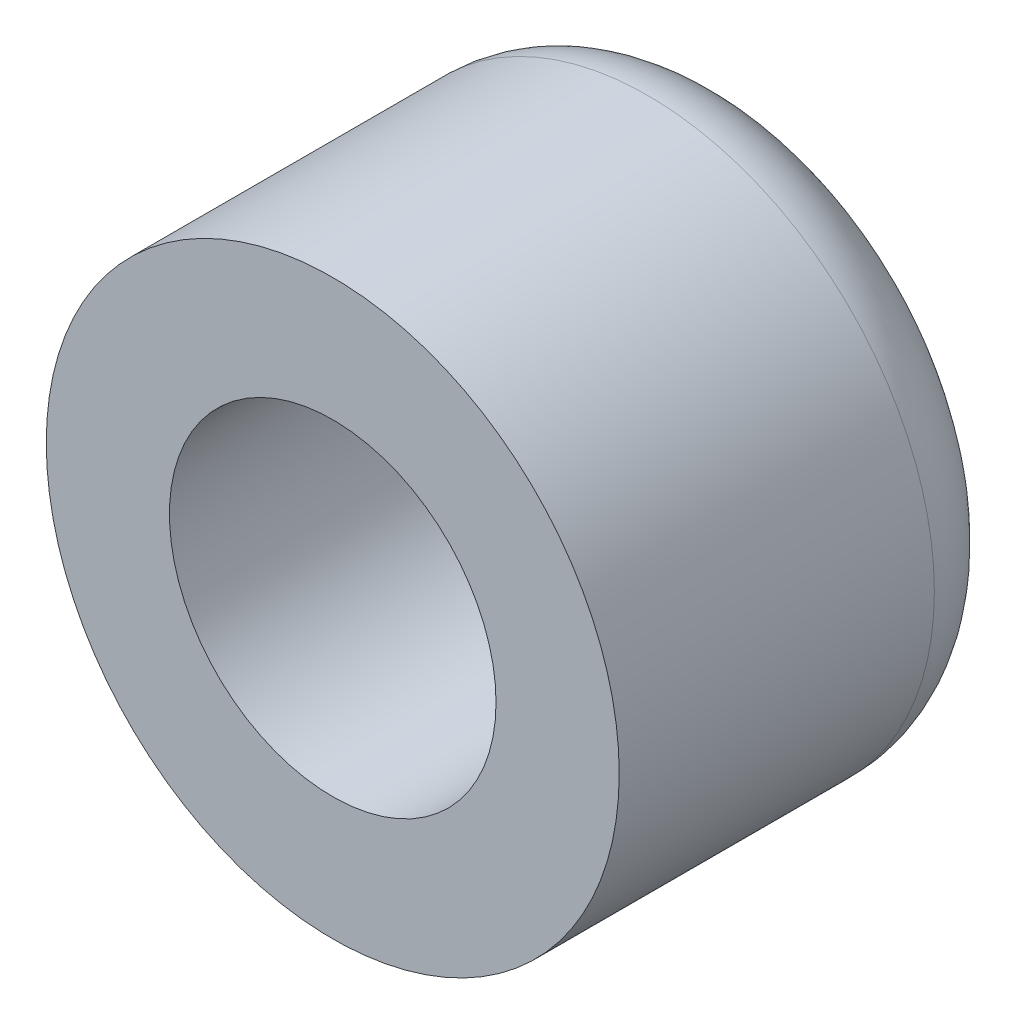
from build123d import *

# Parameters (mm, degrees)
SKETCH1_R           = 5
BOSS_EXTRUDE1_DEPTH = 7
SKETCH2_R           = 2.85
CUT_EXTRUDE1_DEPTH  = 5.5
FILLET1_R           = 1.5


with BuildPart() as part:
    # Sketch1 → Boss-Extrude1 (new body)
    with BuildSketch(Plane(origin=(0, 0, 0), x_dir=(0, 1, 0), z_dir=(0, 0, 1))):
        with Locations(Location((0, 0, 0), (0, 0, 270))):
            Circle(SKETCH1_R)
    extrude(amount=BOSS_EXTRUDE1_DEPTH)

    # Sketch2 → Cut-Extrude1 (cut)
    with BuildSketch(Plane.XY.offset(7)):
        Circle(SKETCH2_R)
    extrude(amount=-CUT_EXTRUDE1_DEPTH, mode=Mode.SUBTRACT)

    # Fillet1
    fillet1_edges = [part.edges().sort_by_distance(p)[0] for p in [
        (-5, 0, 0),
    ]]
    fillet(fillet1_edges, radius=FILLET1_R)


solid = part.part
